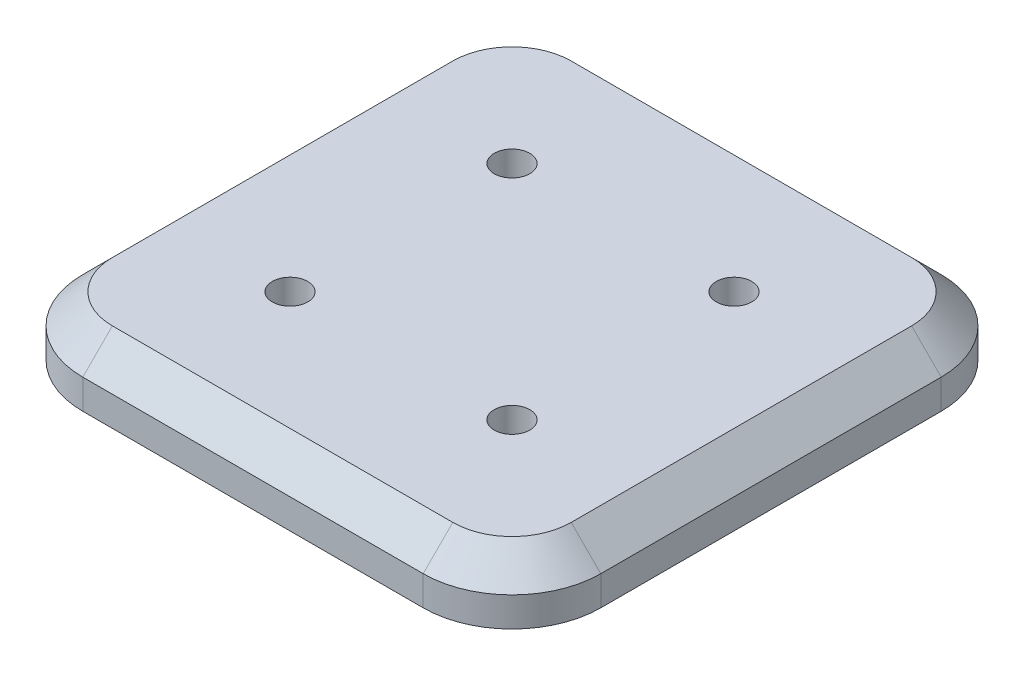
from build123d import *

# Parameters (mm, degrees)
SKETCH_1_W          = 175
SKETCH_1_H          = 175
EXTRUDE_1_DEPTH     = 20
FILLET_1_R          = 30
CHAMFER_1_SIZE      = 10
HOLE_WIZARD_1_D     = 12
HOLE_WIZARD_1_DEPTH = 10
HOLE_WIZARD_1_TIP   = 3.605163714
HOLE_WIZARD_2_D     = 12
HOLE_WIZARD_2_DEPTH = 10
HOLE_WIZARD_2_TIP   = 3.605163714


with BuildPart() as part:
    # 草圖1 → 擠出1 (new body)
    with BuildSketch(Plane(origin=(0, 0, 0), x_dir=(-1, 0, 0), z_dir=(0, 1, 0))):
        Rectangle(SKETCH_1_W, SKETCH_1_H)
    extrude(amount=EXTRUDE_1_DEPTH)

    # 圓角1
    fillet_1_edges = [part.edges().sort_by_distance(p)[0] for p in [
        (-87.5, 10, -87.5),
        (87.5, 10, -87.5),
        (87.5, 10, 87.5),
        (-87.5, 10, 87.5),
    ]]
    fillet(fillet_1_edges, radius=FILLET_1_R)

    # 倒角1
    chamfer_1_edges = [part.edges().sort_by_distance(p)[0] for p in [
        (0, 20, -87.5),
        (87.5, 20, 0),
        (-87.5, 20, 0),
        (0, 20, 87.5),
        (78.713203436, 20, 78.713203436),
        (-78.713203436, 20, 78.713203436),
        (-78.713203436, 20, -78.713203436),
        (78.713203436, 20, -78.713203436),
    ]]
    chamfer(chamfer_1_edges, length=CHAMFER_1_SIZE)

    # 孔1
    with Locations(Plane(origin=(0, 0, 0), x_dir=(-1, 0, 0), z_dir=(0, -1, 0))):
        with Locations((62.5, -62.5), (-62.5, -62.5), (-62.5, 62.5), (62.5, 62.5)):
            Hole(HOLE_WIZARD_1_D / 2, depth=HOLE_WIZARD_1_DEPTH)
            with Locations((0, 0, -(HOLE_WIZARD_1_DEPTH + HOLE_WIZARD_1_TIP / 2))):  # 118° drill point
                Cone(0, HOLE_WIZARD_1_D / 2, HOLE_WIZARD_1_TIP, mode=Mode.SUBTRACT)

    # 孔2
    with Locations(Plane(origin=(0, 20, 0), x_dir=(1, 0, 0), z_dir=(0, 1, 0))):
        with Locations((-37.5, 37.5), (-37.5, -37.5), (37.5, -37.5), (37.5, 37.5)):
            Hole(HOLE_WIZARD_2_D / 2, depth=HOLE_WIZARD_2_DEPTH)
            with Locations((0, 0, -(HOLE_WIZARD_2_DEPTH + HOLE_WIZARD_2_TIP / 2))):  # 118° drill point
                Cone(0, HOLE_WIZARD_2_D / 2, HOLE_WIZARD_2_TIP, mode=Mode.SUBTRACT)


solid = part.part
